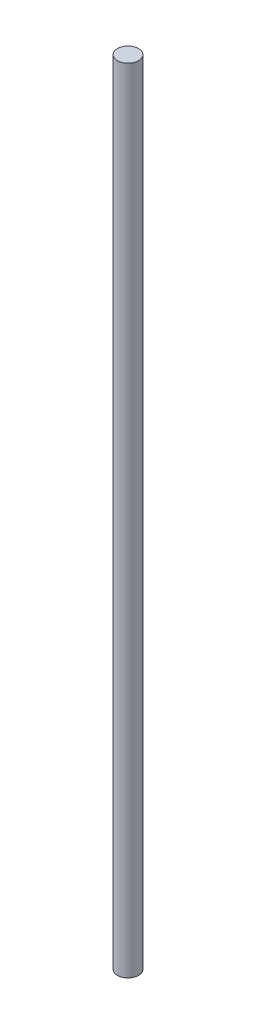
from build123d import *

# Parameters (mm, degrees)
PACK_LINEER_RAY_D16_1_START = 300
SKETCH1_R                   = 8
PACK_LINEER_RAY_D16_1_DEPTH = 600


with BuildPart() as part:
    # Sketch1 → PACK_lineer_ray_D16_1 (new body)
    with BuildSketch(Plane(origin=(0, 0, 0), x_dir=(1, 0, 0), z_dir=(0, 1, 0)).offset(PACK_LINEER_RAY_D16_1_START)):
        with Locations(Location((150, 400, 0), (0, 0, 270))):
            Circle(SKETCH1_R)
    extrude(amount=PACK_LINEER_RAY_D16_1_DEPTH)


solid = part.part
